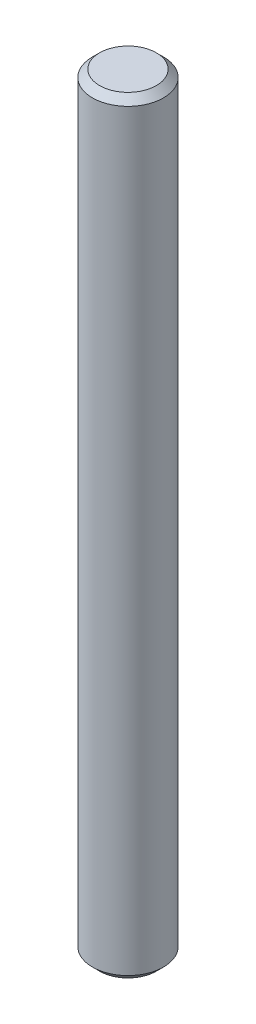
from build123d import *

# Parameters (mm, degrees)
CHAMFER_1_SIZE = 1


with BuildPart() as part:
    # 草图1 → 旋转1 (revolve)
    with BuildSketch(Plane.XY, mode=Mode.PRIVATE) as revolve_1_sk:
        Polygon((0, 54), (5, 54), (5, 30), (5, -30), (5, -54), (0, -54), align=None)
    revolve(revolve_1_sk.sketch.rotate(Axis((0, 54, 0), (0, -1, 0)), 180), axis=Axis((0, 54, 0), (0, -1, 0)))

    # 倒角1
    chamfer_1_edges = [part.edges().sort_by_distance(p)[0] for p in [
        (5, -54, 0),
        (5, 54, 0),
    ]]
    chamfer(chamfer_1_edges, length=CHAMFER_1_SIZE)


solid = part.part
